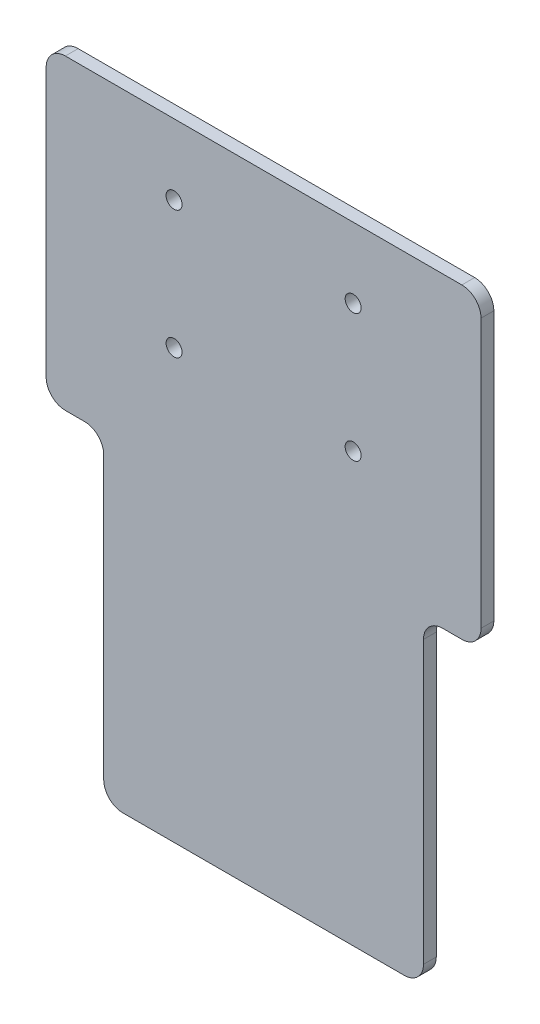
from build123d import *

# Parameters (mm, degrees)
SKETCH_1_W          = 68
SKETCH_1_H          = 58
SKETCH_1_R          = 1.25
EXTRUDE_1_DEPTH     = 2
SKETCH_2_W          = 2
SKETCH_2_H          = 40
EXTRUDE_2_DEPTH     = 68
SKETCH_3_W          = 9
SKETCH_3_H          = 50
CUT_EXTRUDE_1_DEPTH = 10
FILLET_1_R          = 3


with BuildPart() as part:
    # 草图1 → 凸台-拉伸1 (new body)
    with BuildSketch(Plane.XY):
        with Locations((34, 29)):
            Rectangle(SKETCH_1_W, SKETCH_1_H)
        with Locations((48, 27)):
            Circle(SKETCH_1_R, mode=Mode.SUBTRACT)
        with Locations(Location((20, 27, 0), (0, 0, 180))):
            Circle(SKETCH_1_R, mode=Mode.SUBTRACT)
        with Locations((48, 47)):
            Circle(SKETCH_1_R, mode=Mode.SUBTRACT)
        with Locations(Location((20, 47, 0), (0, 0, 180))):
            Circle(SKETCH_1_R, mode=Mode.SUBTRACT)
    extrude(amount=EXTRUDE_1_DEPTH)

    # 草图2 → 凸台-拉伸2 (add)
    with BuildSketch(Plane(origin=(68, 0, 0), x_dir=(0, 0, -1), z_dir=(1, 0, 0))):
        with Locations((-1, -20)):
            Rectangle(SKETCH_2_W, SKETCH_2_H)
    extrude(amount=-EXTRUDE_2_DEPTH)

    # 草图3 → 切除-拉伸1 (cut)
    with BuildSketch(Plane.XY.offset(2)):
        with Locations((4.5, -15)):
            Rectangle(SKETCH_3_W, SKETCH_3_H)
        with Locations((63.5, -15)):
            Rectangle(SKETCH_3_W, SKETCH_3_H)
    extrude(amount=-CUT_EXTRUDE_1_DEPTH, mode=Mode.SUBTRACT)

    # 圆角1
    fillet_1_edges = [part.edges().sort_by_distance(p)[0] for p in [
        (59, -40, 1),
        (9, -40, 1),
        (0, 10, 1),
        (9, 10, 1),
        (68, 10, 1),
        (59, 10, 1),
        (0, 58, 1),
        (68, 58, 1),
    ]]
    fillet(fillet_1_edges, radius=FILLET_1_R)


solid = part.part
